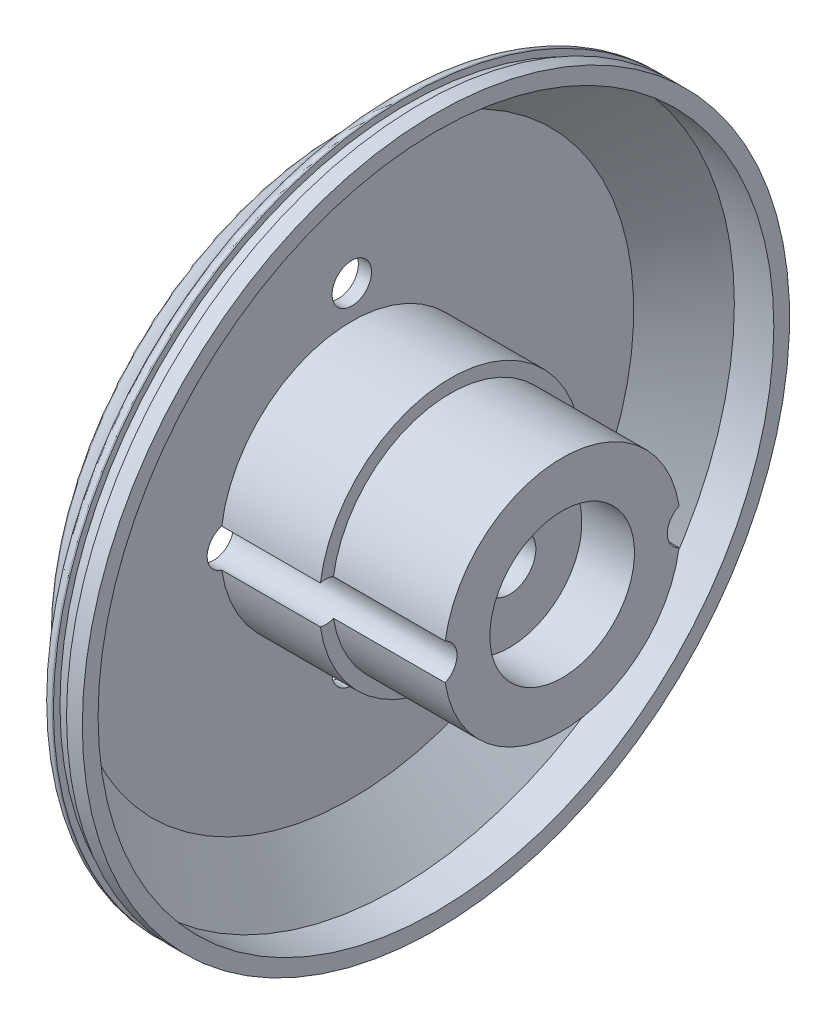
from build123d import *

# Parameters (mm, degrees)
FILLET1_R          = 1
SKETCH3_R          = 1.5
CUT_EXTRUDE2_DEPTH = 42.667973917


with BuildPart() as part:
    # Sketch1 → Revolve1 (revolve)
    with BuildSketch(Plane.XY, mode=Mode.PRIVATE) as revolve1_sk:
        with BuildLine():
            Line((4, 2), (4, 5.5))
            Line((4, 5.5), (0, 5.5))
            Line((0, 5.5), (0, 22))
            ThreePointArc((0, 22), (2.598670777, 24.129792144), (4.5, 26.9))
            Line((4.5, 26.9), (5.2, 26.9))
            Line((5.2, 26.9), (5.2, 26.4))
            Line((5.2, 26.4), (6.2, 26.4))
            Line((6.2, 26.4), (6.2, 26.9))
            Line((6.2, 26.9), (7.4, 26.9))
            Line((7.4, 26.9), (7.4, 25.7))
            Line((7.4, 25.7), (4.4, 25.7))
            Line((4.4, 25.7), (1, 21.446887131))
            Line((1, 21.446887131), (1, 10))
            Line((1, 10), (8.5, 10))
            Line((8.5, 10), (8.5, 9))
            Line((8.5, 9), (17, 9))
            Line((17, 9), (17, 5.5))
            Line((17, 5.5), (13, 5.5))
            Line((13, 5.5), (13, 2))
            Line((13, 2), (4, 2))
        make_face()
    revolve(revolve1_sk.sketch.rotate(Axis((0, 0, 0), (1, 0, 0)), 90), axis=Axis((0, 0, 0), (1, 0, 0)))

    # Fillet1
    fillet1_edges = [part.edges().sort_by_distance(p)[0] for p in [
        (4.5, 0, -26.9),
        (0, 0, -22),
    ]]
    fillet(fillet1_edges, radius=FILLET1_R)

    # Sketch3 → Cut-Extrude2 (cut, through all)
    with BuildSketch(Plane.ZY):
        with Locations(Location((-9.5, 0, 0), (0, 0, 270))):
            Circle(SKETCH3_R)
        with Locations(Location((0, 12.5, 0), (0, 0, 270))):
            Circle(SKETCH3_R)
        with Locations(Location((9.5, 0, 0), (0, 0, 270))):
            Circle(SKETCH3_R)
        with Locations(Location((0, -12.5, 0), (0, 0, 270))):
            Circle(SKETCH3_R)
    extrude(amount=-CUT_EXTRUDE2_DEPTH, mode=Mode.SUBTRACT)


solid = part.part
